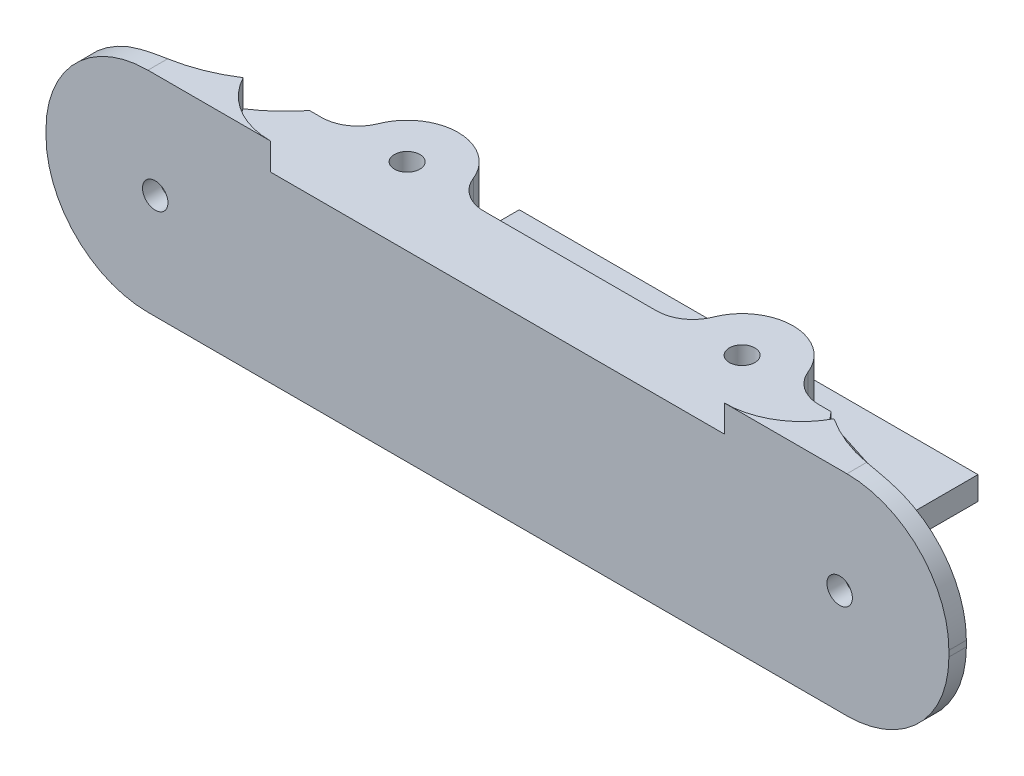
from build123d import *

# Parameters (mm, degrees)
BOSS_EXTRUDE1_DEPTH = 3.2
BOSS_EXTRUDE2_START = 25.6
BOSS_EXTRUDE2_DEPTH = 25.6
SKETCH9_R           = 7
BOSS_EXTRUDE3_DEPTH = 25.6
BOSS_EXTRUDE4_DEPTH = 2
BOSS_EXTRUDE5_START = -46
BOSS_EXTRUDE5_DEPTH = 2
FILLET2_R           = 14
SKETCH12_R          = 1.75
CUT_EXTRUDE1_DEPTH  = 76.429503628
SKETCH15_R          = 3.5
CUT_EXTRUDE4_DEPTH  = 75.362423424
SKETCH16_R          = 1.75
CUT_EXTRUDE5_DEPTH  = 77.574734855
CUT_EXTRUDE6_DEPTH  = 3.7
FILLET3_R           = 5


with BuildPart() as part:
    # Sketch5 → Boss-Extrude1 (new body)
    with BuildSketch(Plane(origin=(0, 0, 0), x_dir=(1, 0, 0), z_dir=(0, 1, 0))):
        with BuildLine():
            Line((-62, 0), (62, 0))
            Line((62, 0), (62, 2.4))
            Line((62, 2.4), (51.5, 2.4))
            ThreePointArc((51.5, 2.4), (37.357864376, 8.257864376), (31.5, 22.4))
            Line((31.5, 22.4), (31.5, 34.5))
            Line((31.5, 34.5), (-31.5, 34.5))
            Line((-31.5, 34.5), (-31.5, 22.4))
            ThreePointArc((-31.5, 22.4), (-37.357864376, 8.257864376), (-51.5, 2.4))
            Line((-51.5, 2.4), (-62, 2.4))
            Line((-62, 2.4), (-62, 0))
        make_face()
    extrude(amount=-BOSS_EXTRUDE1_DEPTH)

    # Sketch8 → Boss-Extrude2 (add)
    with BuildSketch(Plane(origin=(0, 0, 0), x_dir=(1, 0, 0), z_dir=(0, 1, 0)).offset(BOSS_EXTRUDE2_START)):
        with BuildLine():
            Line((-35.807963803, 10), (35.807963803, 10))
            ThreePointArc((35.807963803, 10), (42.782202113, 4.4), (51.5, 2.4))
            Line((51.5, 2.4), (62, 2.4))
            Line((62, 2.4), (62, 0))
            Line((62, 0), (-62, 0))
            Line((-62, 0), (-62, 2.4))
            Line((-62, 2.4), (-51.5, 2.4))
            ThreePointArc((-51.5, 2.4), (-42.782202113, 4.4), (-35.807963803, 10))
        make_face()
    extrude(amount=-BOSS_EXTRUDE2_DEPTH)

    # Sketch9 → Boss-Extrude3 (add)
    with BuildSketch(Plane(origin=(0, 0, 0), x_dir=(1, 0, 0), z_dir=(0, 1, 0))):
        with Locations((-23, 10.6)):
            Circle(SKETCH9_R)
        with Locations((23, 10.6)):
            Circle(SKETCH9_R)
    extrude(amount=BOSS_EXTRUDE3_DEPTH)

    # Sketch10 → Boss-Extrude4 (add, symmetric)
    with BuildSketch(Plane(origin=(23, 0, 0), x_dir=(0, 0, -1), z_dir=(1, 0, 0))):
        Polygon((16.2, 16.6), (16.2, 0), (27.5, 0), align=None)
    extrude(amount=BOSS_EXTRUDE4_DEPTH, both=True)

    # Sketch10<4> → Boss-Extrude5 (add, symmetric)
    with BuildSketch(Plane(origin=(23, 0, 0), x_dir=(0, 0, -1), z_dir=(1, 0, 0)).offset(BOSS_EXTRUDE5_START)):
        Polygon((16.2, 16.6), (16.2, 0), (27.5, 0), align=None)
    extrude(amount=BOSS_EXTRUDE5_DEPTH, both=True)

    # Fillet2
    fillet2_edges = [part.edges().sort_by_distance(p)[0] for p in [
        (62, -3.2, -1.2),
        (62, 25.6, -1.2),
        (-62, -3.2, -1.2),
        (-62, 25.6, -1.2),
    ]]
    fillet(fillet2_edges, radius=FILLET2_R)

    # Sketch12 → Cut-Extrude1 (cut, through all)
    with BuildSketch(Plane.XY):
        with Locations((-47, 11.2)):
            Circle(SKETCH12_R)
        with Locations((47, 11.2)):
            Circle(SKETCH12_R)
    extrude(amount=-CUT_EXTRUDE1_DEPTH, mode=Mode.SUBTRACT)

    # Sketch15 → Cut-Extrude4 (cut, through all)
    with BuildSketch(Plane(origin=(0, 0, -2.4), x_dir=(-1, 0, 0), z_dir=(0, 0, -1))):
        with Locations(Location((-47, 11.2, 0), (0, 0, 180))):
            Circle(SKETCH15_R)
        with Locations(Location((47, 11.2, 0), (0, 0, 180))):
            Circle(SKETCH15_R)
    extrude(amount=CUT_EXTRUDE4_DEPTH, mode=Mode.SUBTRACT)

    # Sketch16 → Cut-Extrude5 (cut, through all)
    with BuildSketch(Plane(origin=(0, 25.6, 0), x_dir=(1, 0, 0), z_dir=(0, 1, 0))):
        with Locations(Location((-23, 10.6, 0), (0, 0, 270))):
            Circle(SKETCH16_R)
        with Locations(Location((23, 10.6, 0), (0, 0, 270))):
            Circle(SKETCH16_R)
    extrude(amount=-CUT_EXTRUDE5_DEPTH, mode=Mode.SUBTRACT)

    # Sketch17 → Cut-Extrude6 (cut)
    with BuildSketch(Plane(origin=(0, 25.6, 0), x_dir=(1, 0, 0), z_dir=(0, 1, 0))):
        with BuildLine():
            Line((-31.2, 21.2), (31.2, 21.2))
            ThreePointArc((31.2, 21.2), (41.8, 10.6), (31.2, 0))
            Line((31.2, 0), (-31.2, 0))
            ThreePointArc((-31.2, 0), (-41.8, 10.6), (-31.2, 21.2))
        make_face()
    extrude(amount=-CUT_EXTRUDE6_DEPTH, mode=Mode.SUBTRACT)

    # Fillet3
    fillet3_edges = [part.edges().sort_by_distance(p)[0] for p in [
        (16.02576169, 10.95, -10),
        (-29.97423831, 10.95, -10),
        (-16.02576169, 10.95, -10),
        (29.97423831, 10.95, -10),
    ]]
    fillet(fillet3_edges, radius=FILLET3_R)


solid = part.part
